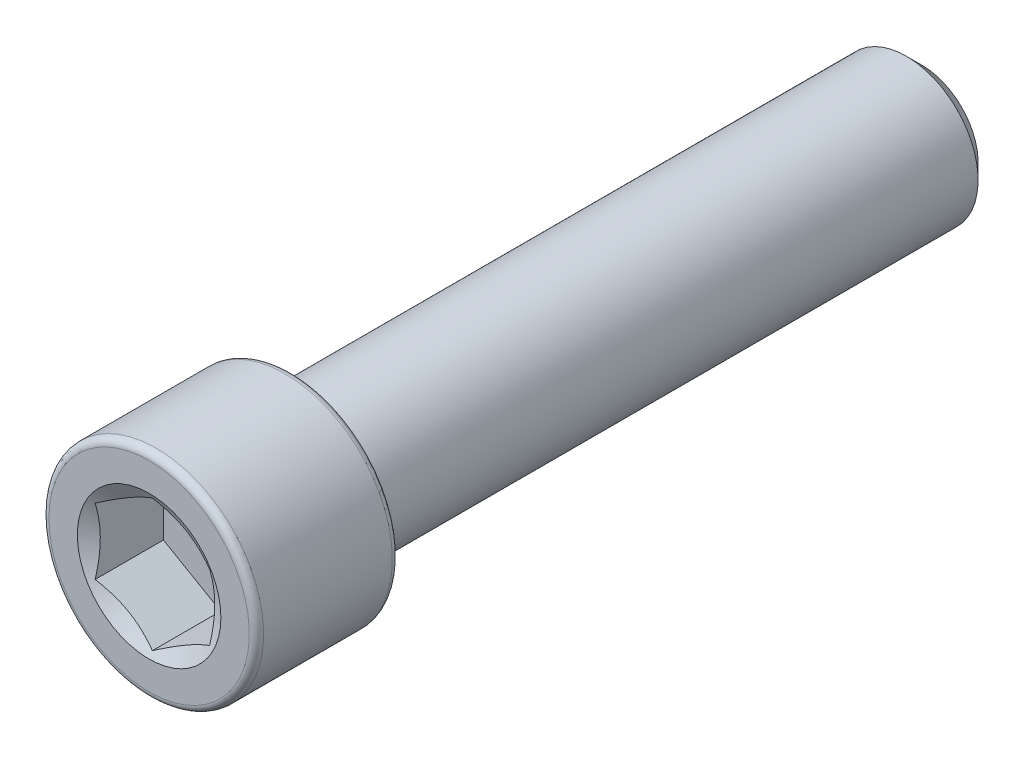
from build123d import *

# Parameters (mm, degrees)
CUT_EXTRUDE1_START = 21.43125
CUT_EXTRUDE1_DEPTH = 3.96875


with BuildPart() as part:
    # Sketch2 → Revolve1 (revolve)
    with BuildSketch(Plane(origin=(0, 0, 0), x_dir=(0, 0, -1), z_dir=(1, 0, 0)), mode=Mode.PRIVATE) as revolve1_sk:
        with BuildLine():
            Line((21.43125, 0), (21.43125, 3.122083333))
            Line((21.43125, 3.122083333), (20.584583333, 3.96875))
            Line((20.584583333, 3.96875), (-13.49375, 3.96875))
            Line((-13.49375, 3.96875), (-13.49375, 5.55625))
            ThreePointArc((-13.49375, 5.55625), (-13.609991996, 5.836883004), (-13.890625, 5.953125))
            Line((-13.890625, 5.953125), (-21.034375, 5.953125))
            ThreePointArc((-21.034375, 5.953125), (-21.315008004, 5.836883004), (-21.43125, 5.55625))
            Line((-21.43125, 5.55625), (-21.43125, 0))
            Line((-21.43125, 0), (21.43125, 0))
        make_face()
    revolve(revolve1_sk.sketch.rotate(Axis((0, 0, -21.43125), (0, 0, 1)), 90), axis=Axis((0, 0, -21.43125), (0, 0, 1)))

    # Sketch3 → Cut-Extrude1 (cut)
    with BuildSketch(Plane.XY.offset(CUT_EXTRUDE1_START)):
        Polygon((-3.175, 1.833087105), (-3.175, -1.833087105), (0, -3.666174209), (3.175, -1.833087105), (3.175, 1.833087105), (0, 3.666174209), align=None)
    extrude(amount=-CUT_EXTRUDE1_DEPTH, mode=Mode.SUBTRACT)

    # Cut-Extrude2 cone 1 section (through the dimple's axis) → Cut-Extrude2 (revolve, cut)
    with BuildSketch(Plane(origin=(0, 0, 21.43125), x_dir=(0, -1, 0), z_dir=(1, 0, 0))):
        Polygon((0, 0), (3.981186841, 0), (0, 2.298539294), align=None)
    revolve(axis=Axis((0, 0, 21.43125), (0, 0, -1)), mode=Mode.SUBTRACT)


solid = part.part
